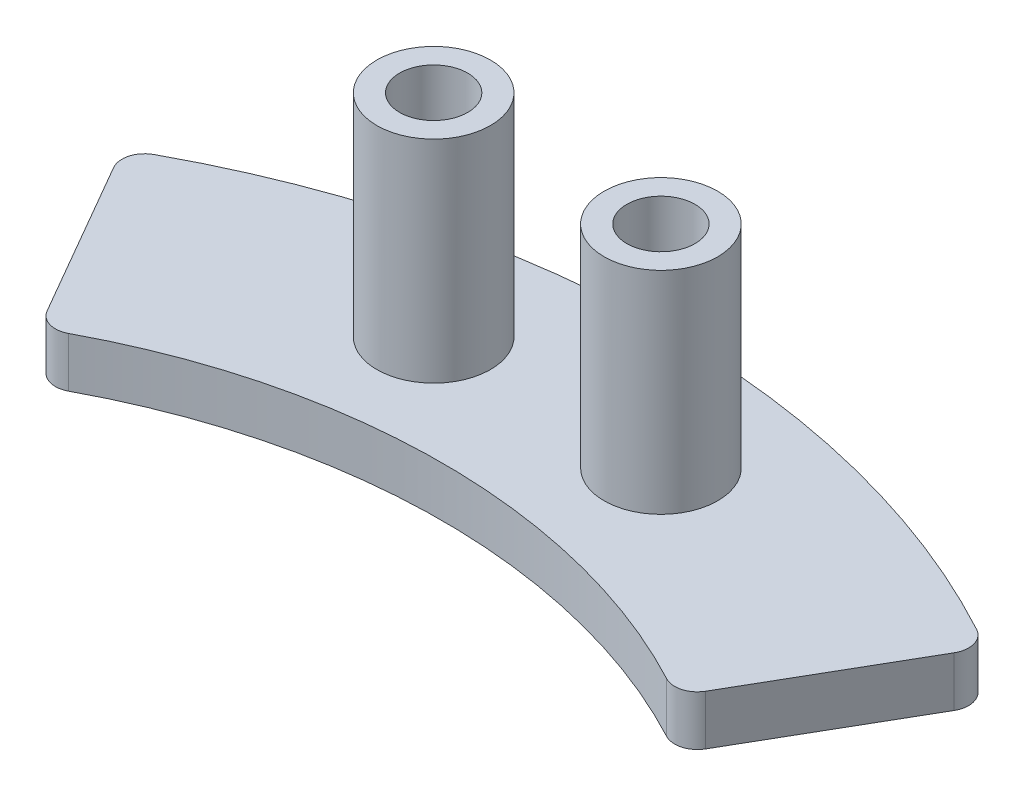
from build123d import *

# Parameters (mm, degrees)
BOSS_EXTRUDE1_DEPTH = 2.2
SKETCH2_R           = 2.5
BOSS_EXTRUDE2_DEPTH = 9.3
SKETCH5_R           = 1.5
CUT_EXTRUDE1_DEPTH  = 3.5
SKETCH6_R           = 1.5
CUT_EXTRUDE2_DEPTH  = 1
FILLET1_R           = 1


with BuildPart() as part:
    # Sketch1 → Boss-Extrude1 (new body)
    with BuildSketch(Plane(origin=(0, 0, 0), x_dir=(1, 0, 0), z_dir=(0, 1, 0))):
        with BuildLine():
            Line((-19, 32.908965344), (-14, 24.248711306))
            ThreePointArc((-14, 24.248711306), (0, 28), (14, 24.248711306))
            Line((14, 24.248711306), (19, 32.908965344))
            ThreePointArc((19, 32.908965344), (0, 38), (-19, 32.908965344))
        make_face()
    extrude(amount=BOSS_EXTRUDE1_DEPTH)

    # Sketch2 → Boss-Extrude2 (add)
    with BuildSketch(Plane(origin=(0, 2.2, 0), x_dir=(1, 0, 0), z_dir=(0, 1, 0))):
        with Locations(Location((-5, 32.619012861, 0), (0, 0, 90))):
            Circle(SKETCH2_R)
        with Locations(Location((5, 32.619012861, 0), (0, 0, 90))):
            Circle(SKETCH2_R)
    extrude(amount=BOSS_EXTRUDE2_DEPTH)

    # Sketch5 → Cut-Extrude1 (cut)
    with BuildSketch(Plane(origin=(0, 11.5, 0), x_dir=(1, 0, 0), z_dir=(0, 1, 0))):
        with Locations(Location((-5, 32.619012861, 0), (0, 0, 270))):
            Circle(SKETCH5_R)
        with Locations(Location((5, 32.619012861, 0), (0, 0, 270))):
            Circle(SKETCH5_R)
    extrude(amount=-CUT_EXTRUDE1_DEPTH, mode=Mode.SUBTRACT)

    # Sketch6 → Cut-Extrude2 (cut)
    with BuildSketch(Plane.XZ):
        with Locations(Location((0, -33, 0), (0, 0, 270))):
            Circle(SKETCH6_R)
    extrude(amount=-CUT_EXTRUDE2_DEPTH, mode=Mode.SUBTRACT)

    # Fillet1
    fillet1_edges = [part.edges().sort_by_distance(p)[0] for p in [
        (19, 1.1, -32.908965344),
        (14, 1.1, -24.248711306),
        (-14, 1.1, -24.248711306),
        (-19, 1.1, -32.908965344),
    ]]
    fillet(fillet1_edges, radius=FILLET1_R)


solid = part.part
